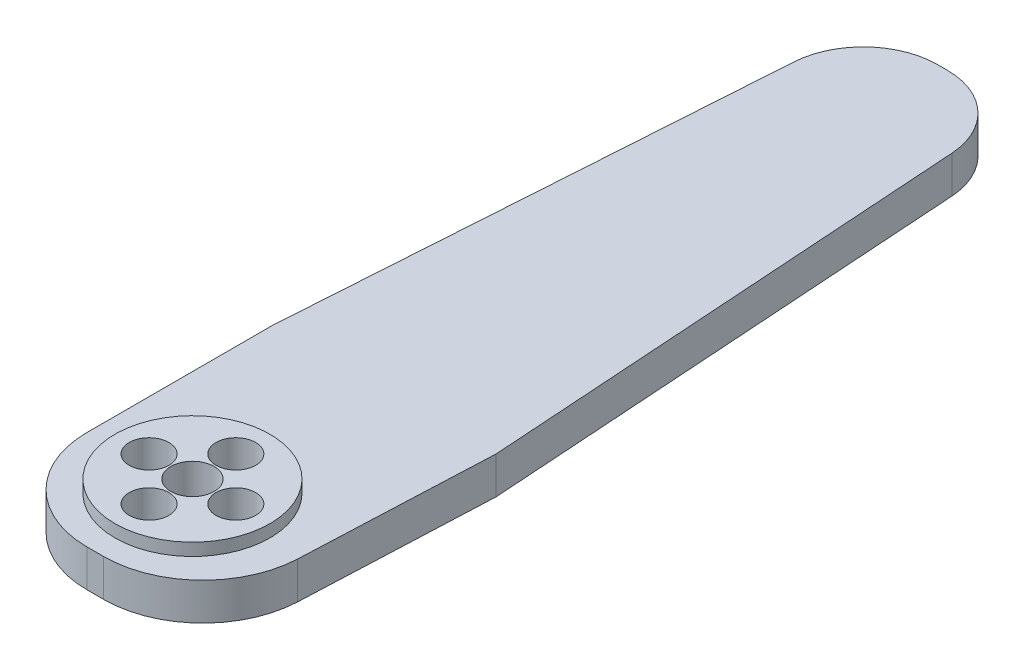
from build123d import *

# Parameters (mm, degrees)
BOSS_1_DEPTH  = 6
S_CYL2_R      = 12.5
BOSS_2_DEPTH  = 2
S_HOLE3_R     = 3.5
HOLE_3_DEPTH  = 8.2
S_HOLE4_R     = 1.7
HOLE_4_DEPTH  = 8.2
S_HOLE5_R     = 1.7
HOLE_5_DEPTH  = 8.2
S_HOLE6_R     = 1.7
HOLE_6_DEPTH  = 8.2
S_HOLE7_R     = 1.7
HOLE_7_DEPTH  = 8.2
S_HOLE8_R     = 3.2
HOLE_8_DEPTH  = 5.1
S_HOLE9_R     = 3.2
HOLE_9_DEPTH  = 5.1
S_HOLE10_R    = 3.2
HOLE_10_DEPTH = 5.1
S_HOLE11_R    = 3.2
HOLE_11_DEPTH = 5.1


with BuildPart() as part:
    # S_prism1 → Boss_1 (new body)
    with BuildSketch(Plane(origin=(0, 0, 0), x_dir=(1, 0, 0), z_dir=(0, 1, 0))):
        with BuildLine():
            Line((-1, -16), (1.6805, -16))
            ThreePointArc((1.6805, -16), (12.745771818, -11.556826983), (17.6654, -0.695))
            Line((17.6654, -0.695), (19, 30))
            Line((19, 30), (13.7468, 108.7982))
            ThreePointArc((13.7468, 108.7982), (9.971633889, 116.762968295), (1.7734, 120))
            Line((1.7734, 120), (0.2266, 120))
            ThreePointArc((0.2266, 120), (-7.971633889, 116.762968295), (-11.7468, 108.7982))
            Line((-11.7468, 108.7982), (-17, 30))
            Line((-17, 30), (-17, 0))
            ThreePointArc((-17, 0), (-12.3137, -11.3137), (-1, -16))
        make_face()
    extrude(amount=BOSS_1_DEPTH)

    # S_cyl2 → Boss_2 (add)
    with BuildSketch(Plane(origin=(0, 6, 0), x_dir=(1, 0, 0), z_dir=(0, 1, 0))):
        with Locations(Location((0, 0, 0), (0, 0, 270))):
            Circle(S_CYL2_R)
    extrude(amount=BOSS_2_DEPTH)

    # S_hole3 → Hole_3 (cut)
    with BuildSketch(Plane(origin=(0, -0.1, 0), x_dir=(1, 0, 0), z_dir=(0, 1, 0))):
        with Locations(Location((0, 0, 0), (0, 0, 270))):
            Circle(S_HOLE3_R)
    extrude(amount=HOLE_3_DEPTH, mode=Mode.SUBTRACT)

    # S_hole4 → Hole_4 (cut)
    with BuildSketch(Plane(origin=(0, -0.1, 0), x_dir=(1, 0, 0), z_dir=(0, 1, 0))):
        with Locations(Location((7, 0, 0), (0, 0, 270))):
            Circle(S_HOLE4_R)
    extrude(amount=HOLE_4_DEPTH, mode=Mode.SUBTRACT)

    # S_hole5 → Hole_5 (cut)
    with BuildSketch(Plane(origin=(0, -0.1, 0), x_dir=(1, 0, 0), z_dir=(0, 1, 0))):
        with Locations(Location((0, -7, 0), (0, 0, 270))):
            Circle(S_HOLE5_R)
    extrude(amount=HOLE_5_DEPTH, mode=Mode.SUBTRACT)

    # S_hole6 → Hole_6 (cut)
    with BuildSketch(Plane(origin=(0, -0.1, 0), x_dir=(1, 0, 0), z_dir=(0, 1, 0))):
        with Locations(Location((-7, 0, 0), (0, 0, 270))):
            Circle(S_HOLE6_R)
    extrude(amount=HOLE_6_DEPTH, mode=Mode.SUBTRACT)

    # S_hole7 → Hole_7 (cut)
    with BuildSketch(Plane(origin=(0, -0.1, 0), x_dir=(1, 0, 0), z_dir=(0, 1, 0))):
        with Locations(Location((0, 7, 0), (0, 0, 270))):
            Circle(S_HOLE7_R)
    extrude(amount=HOLE_7_DEPTH, mode=Mode.SUBTRACT)

    # S_hole8 → Hole_8 (cut)
    with BuildSketch(Plane(origin=(0, 3, 0), x_dir=(1, 0, 0), z_dir=(0, 1, 0))):
        with Locations(Location((7, 0, 0), (0, 0, 270))):
            Circle(S_HOLE8_R)
    extrude(amount=HOLE_8_DEPTH, mode=Mode.SUBTRACT)

    # S_hole9 → Hole_9 (cut)
    with BuildSketch(Plane(origin=(0, 3, 0), x_dir=(1, 0, 0), z_dir=(0, 1, 0))):
        with Locations(Location((0, -7, 0), (0, 0, 270))):
            Circle(S_HOLE9_R)
    extrude(amount=HOLE_9_DEPTH, mode=Mode.SUBTRACT)

    # S_hole10 → Hole_10 (cut)
    with BuildSketch(Plane(origin=(0, 3, 0), x_dir=(1, 0, 0), z_dir=(0, 1, 0))):
        with Locations(Location((-7, 0, 0), (0, 0, 270))):
            Circle(S_HOLE10_R)
    extrude(amount=HOLE_10_DEPTH, mode=Mode.SUBTRACT)

    # S_hole11 → Hole_11 (cut)
    with BuildSketch(Plane(origin=(0, 3, 0), x_dir=(1, 0, 0), z_dir=(0, 1, 0))):
        with Locations(Location((0, 7, 0), (0, 0, 270))):
            Circle(S_HOLE11_R)
    extrude(amount=HOLE_11_DEPTH, mode=Mode.SUBTRACT)


solid = part.part
